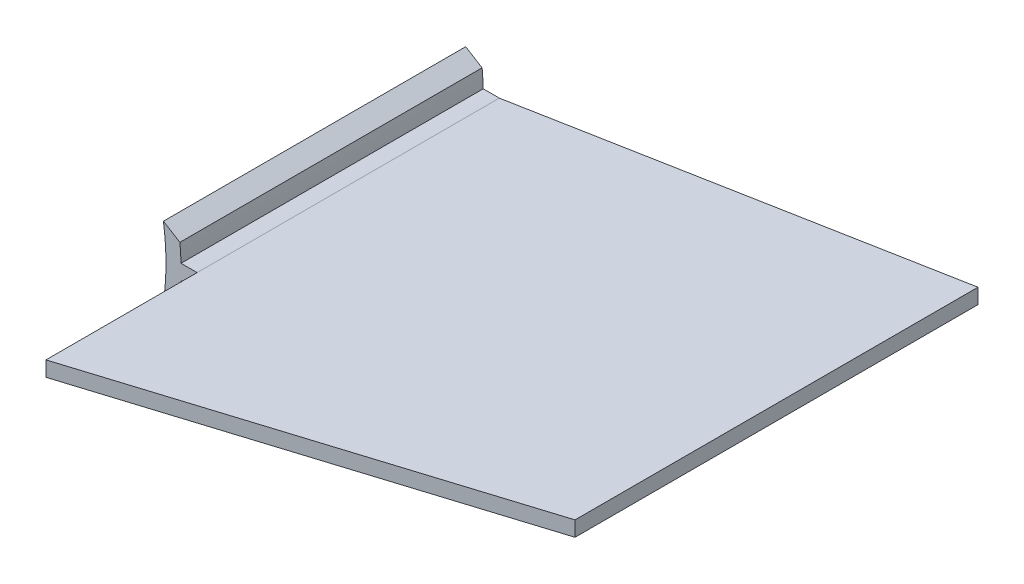
from build123d import *

# Parameters (mm, degrees)
SKETCH_1_R          = 55
EXTRUDE_1_DEPTH     = 190
SKETCH_2_R          = 51.8
CUT_EXTRUDE_1_DEPTH = 186.8
SKETCH_3_R          = 15
CUT_EXTRUDE_2_DEPTH = 10
SKETCH_4_R          = 18.2
SKETCH_4_R_2        = 15
EXTRUDE_2_DEPTH     = 188
SKETCH_5_R          = 55
EXTRUDE_5_DEPTH     = 3.2
EXTRUDE_6_DEPTH     = 1.5
CUT_EXTRUDE_START   = -300
CUT_EXTRUDE_3_DEPTH = 300
EXTRUDE_7_DEPTH     = 60


with BuildPart() as part:
    # 草图1 → 凸台-拉伸1 (new body)
    with BuildSketch(Plane.XY):
        Circle(SKETCH_1_R)
    extrude(amount=EXTRUDE_1_DEPTH)

    # 草图2 → 切除-拉伸1 (cut)
    with BuildSketch(Plane.XY.offset(190)):
        Circle(SKETCH_2_R)
    extrude(amount=-CUT_EXTRUDE_1_DEPTH, mode=Mode.SUBTRACT)

    # 草图3 → 切除-拉伸2 (cut)
    with BuildSketch(Plane(origin=(0, 0, 0), x_dir=(-1, 0, 0), z_dir=(0, 0, -1))):
        Circle(SKETCH_3_R)
    extrude(amount=-CUT_EXTRUDE_2_DEPTH, mode=Mode.SUBTRACT)

    # 草图4 → 凸台-拉伸2 (add)
    with BuildSketch(Plane.XY.offset(3.2)):
        Circle(SKETCH_4_R)
        with Locations(Location((0, 0, 0), (0, 0, 180))):
            Circle(SKETCH_4_R_2, mode=Mode.SUBTRACT)
    extrude(amount=EXTRUDE_2_DEPTH)

    # 草图5 → 凸台-拉伸5 (add)
    with BuildSketch(Plane.XY.offset(190)):
        Circle(SKETCH_5_R)
    extrude(amount=EXTRUDE_5_DEPTH)

    # 草图8 → 凸台-拉伸6 (add, symmetric)
    with BuildSketch(Plane(origin=(0, 0, 0), x_dir=(-1, 0, 0), z_dir=(0, 1, 0))):
        Polygon((-55, 90), (-135, 65), (-135, -15), (-55, 0), (-53, 0), (-53, 90), align=None)
    extrude(amount=EXTRUDE_6_DEPTH, both=True)

    # 草图9 → 切除-拉伸3 (cut)
    with BuildSketch(Plane.XY.offset(193.2).offset(CUT_EXTRUDE_START)):
        with BuildLine():
            Line((24.339487832, -49.321286805), (24.339487832, -150.159347116))
            Line((24.339487832, -150.159347116), (-116.243890066, -150.159347116))
            Line((-116.243890066, -150.159347116), (-116.243890066, 159.53157231))
            Line((-116.243890066, 159.53157231), (24.339487832, 159.53157231))
            Line((24.339487832, 159.53157231), (24.339487832, 49.321286805))
            ThreePointArc((24.339487832, 49.321286805), (55, 0), (24.339487832, -49.321286805))
        make_face()
    extrude(amount=CUT_EXTRUDE_3_DEPTH, mode=Mode.SUBTRACT)


with BuildPart() as body_2:
    # 草图10 → 凸台-拉伸7 (new body)
    with BuildSketch(Plane(origin=(55, 0, 0), x_dir=(1, 0, 0), z_dir=(0, 0, 1))):
        with BuildLine():
            Line((-3.221722702, 1.5), (-0.02045835, 1.5))
            ThreePointArc((-0.02045835, 1.5), (0, 0), (-0.02045835, -1.5))
            Line((-0.02045835, -1.5), (-3.221722702, -1.5))
            ThreePointArc((-3.221722702, -1.5), (-3.302172357, -3.251863624), (-3.441877459, -5))
            Line((-3.441877459, -5), (-6.70465861, -7))
            ThreePointArc((-6.70465861, -7), (-6.2, 0), (-6.70465861, 7))
            Line((-6.70465861, 7), (-3.441877459, 5))
            ThreePointArc((-3.441877459, 5), (-3.302172357, 3.251863624), (-3.221722702, 1.5))
        make_face()
    extrude(amount=EXTRUDE_7_DEPTH)


solid = Compound([part.part, body_2.part])
